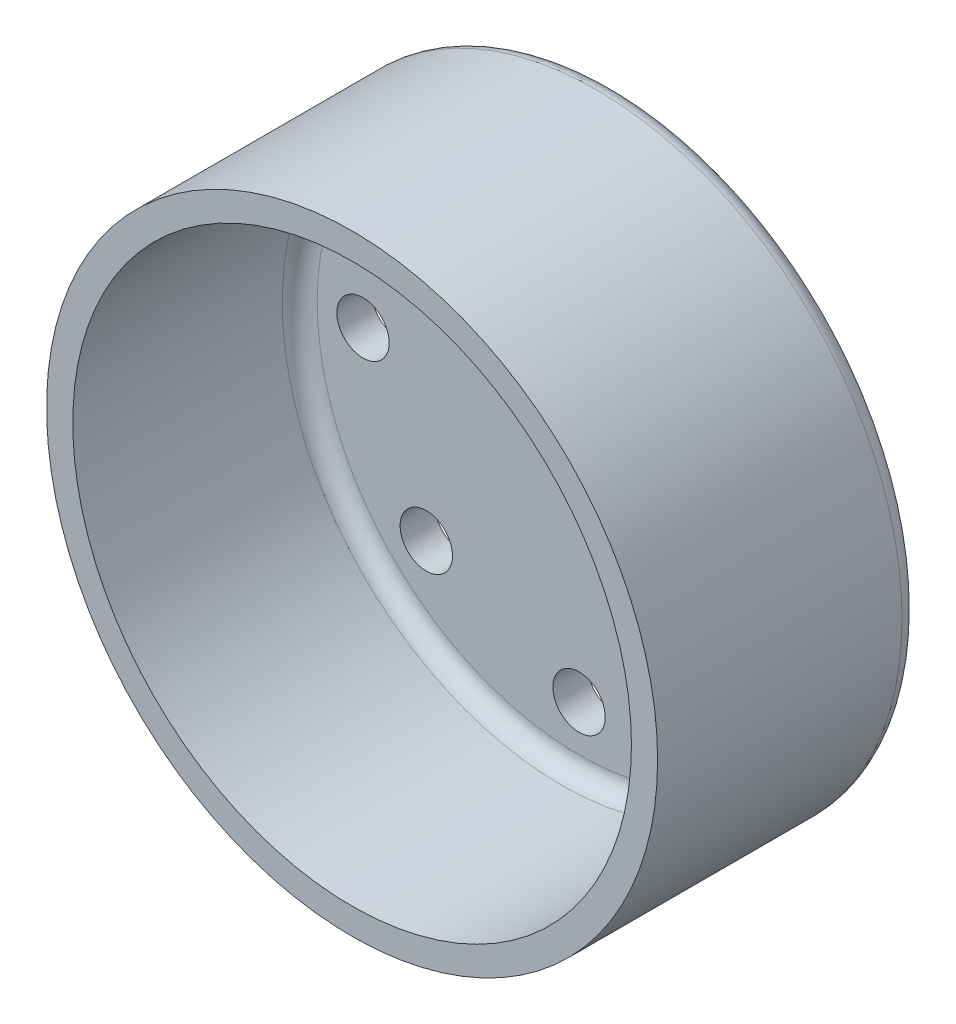
from build123d import *

# Parameters (mm, degrees)
SKETCH1_R           = 35
BOSS_EXTRUDE1_DEPTH = 30
CUT_EXTRUDE1_DEPTH  = 60
CUT_EXTRUDE2_DEPTH  = 60
SKETCH5_R           = 32
CUT_EXTRUDE3_DEPTH  = 26
FILLET3_R           = 2
FILLET4_R           = 2


with BuildPart() as part:
    # Sketch1 → Boss-Extrude1 (new body)
    with BuildSketch(Plane.XY):
        Circle(SKETCH1_R)
    extrude(amount=BOSS_EXTRUDE1_DEPTH)

    # Sketch3 → Cut-Extrude1 (cut)
    with BuildSketch(Plane(origin=(0, 0, 0), x_dir=(-1, 0, 0), z_dir=(0, 0, -1))):
        with BuildLine():
            ThreePointArc((27.75, 0), (24.75, 3), (21.75, 0))
            Line((21.75, 0), (27.75, 0))
        make_face()
        with BuildLine():
            Line((27.75, 0), (21.75, 0))
            ThreePointArc((21.75, 0), (24.75, -3), (27.75, 0))
        make_face()
        with BuildLine():
            ThreePointArc((19.621320344, -15.378679656), (15.378679656, -15.378679656), (15.378679656, -19.621320344))
            Line((15.378679656, -19.621320344), (19.621320344, -15.378679656))
        make_face()
        with BuildLine():
            Line((19.621320344, -15.378679656), (15.378679656, -19.621320344))
            ThreePointArc((15.378679656, -19.621320344), (18.648050297, -20.271638598), (20.5, -17.5))
            ThreePointArc((20.5, -17.5), (20.271638598, -16.351949703), (19.621320344, -15.378679656))
        make_face()
        with BuildLine():
            ThreePointArc((-14.5, -17.5), (-16.351949703, -14.728361402), (-19.621320344, -15.378679656))
            Line((-19.621320344, -15.378679656), (-15.378679656, -19.621320344))
            ThreePointArc((-15.378679656, -19.621320344), (-14.728361402, -18.648050297), (-14.5, -17.5))
        make_face()
        with BuildLine():
            Line((-15.378679656, -19.621320344), (-19.621320344, -15.378679656))
            ThreePointArc((-19.621320344, -15.378679656), (-19.621320344, -19.621320344), (-15.378679656, -19.621320344))
        make_face()
    extrude(amount=-CUT_EXTRUDE1_DEPTH, mode=Mode.SUBTRACT)

    # Sketch3<3> → Cut-Extrude2 (cut)
    with BuildSketch(Plane(origin=(0, 0, 0), x_dir=(-1, 0, 0), z_dir=(0, 0, -1))):
        with BuildLine():
            ThreePointArc((3, -24.75), (2.121320344, -22.628679656), (0, -21.75))
            Line((0, -21.75), (0, -27.75))
            ThreePointArc((0, -27.75), (2.121320344, -26.871320344), (3, -24.75))
        make_face()
        with BuildLine():
            Line((0, -27.75), (0, -21.75))
            ThreePointArc((0, -21.75), (-3, -24.75), (0, -27.75))
        make_face()
        with BuildLine():
            ThreePointArc((-27.75, 0), (-24.75, -3), (-21.75, 0))
            Line((-21.75, 0), (-27.75, 0))
        make_face()
        with BuildLine():
            Line((-27.75, 0), (-21.75, 0))
            ThreePointArc((-21.75, 0), (-24.75, 3), (-27.75, 0))
        make_face()
    extrude(amount=-CUT_EXTRUDE2_DEPTH, mode=Mode.SUBTRACT)

    # Sketch5 → Cut-Extrude3 (cut)
    with BuildSketch(Plane.XY.offset(30)):
        Circle(SKETCH5_R)
    extrude(amount=-CUT_EXTRUDE3_DEPTH, mode=Mode.SUBTRACT)

    # Fillet3
    fillet3_edges = [part.edges().sort_by_distance(p)[0] for p in [
        (-35, 0, 0),
    ]]
    fillet(fillet3_edges, radius=FILLET3_R)

    # Fillet4
    fillet4_edges = [part.edges().sort_by_distance(p)[0] for p in [
        (-32, 0, 4),
    ]]
    fillet(fillet4_edges, radius=FILLET4_R)


solid = part.part
